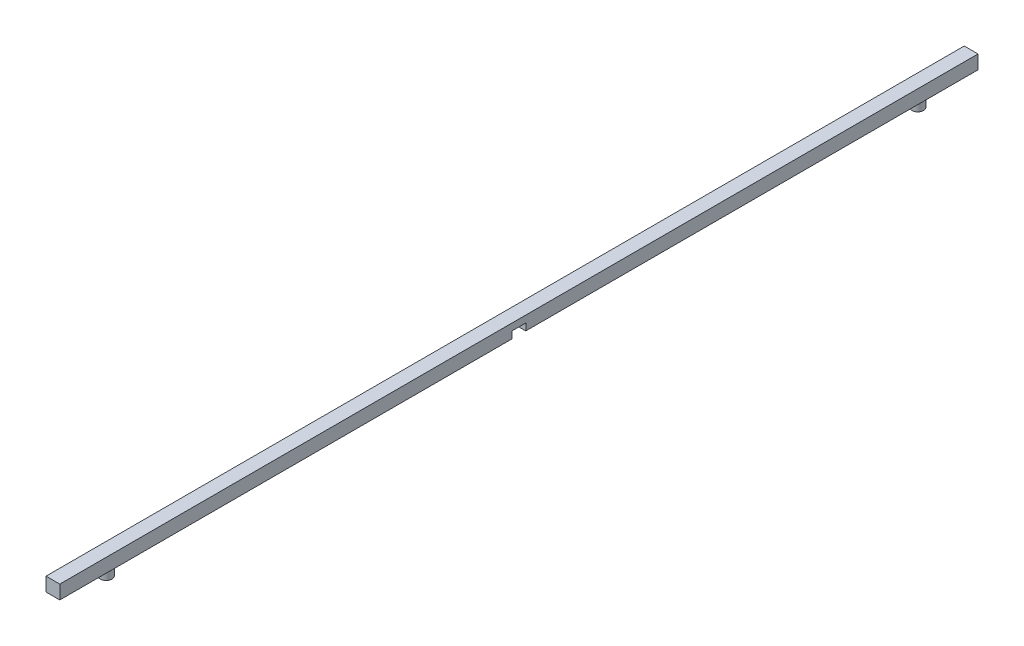
from build123d import *

# Parameters (mm, degrees)
EXTRUDE_1_DEPTH     = 30
SKETCH_2_R          = 10
CUT_EXTRUDE_1_DEPTH = 15
EXTRUDE_START       = 20
SKETCH_3_R          = 12.5
SKETCH_3_R_2        = 10
EXTRUDE_2_DEPTH     = 20


with BuildPart() as part:
    # 草图1 → 凸台-拉伸1 (new body)
    with BuildSketch(Plane(origin=(0, 0, 0), x_dir=(0, 0, -1), z_dir=(1, 0, 0))):
        Polygon((-1000, 30), (1000, 30), (1000, 0), (15, 0), (15, 15), (-15, 15), (-15, 0), (-1000, 0), align=None)
    extrude(amount=EXTRUDE_1_DEPTH)

    # 草图2 → 切除-拉伸1 (cut)
    with BuildSketch(Plane.XZ):
        with Locations(Location((15, 883.8834765, 0), (0, 0, 270))):
            Circle(SKETCH_2_R)
        with Locations(Location((15, -883.8834765, 0), (0, 0, 90))):
            Circle(SKETCH_2_R)
    extrude(amount=-CUT_EXTRUDE_1_DEPTH, mode=Mode.SUBTRACT)

    # 草图3 → 凸台-拉伸2 (add)
    # profile 1 of 2: a face of its own
    with BuildSketch(Plane.XZ.offset(EXTRUDE_START)):
        with Locations(Location((15, 883.8834765, 0), (0, 0, 90))):
            Circle(SKETCH_3_R)
        with Locations(Location((15, 883.8834765, 0), (0, 0, 270))):
            Circle(SKETCH_3_R_2, mode=Mode.SUBTRACT)
    # profile 2 of 2: a face of its own
    with BuildSketch(Plane.XZ.offset(EXTRUDE_START)):
        with Locations(Location((15, -883.8834765, 0), (0, 0, 90))):
            Circle(SKETCH_3_R)
        with Locations(Location((15, -883.8834765, 0), (0, 0, 90))):
            Circle(SKETCH_3_R_2, mode=Mode.SUBTRACT)
    extrude(amount=-EXTRUDE_2_DEPTH)


solid = part.part
